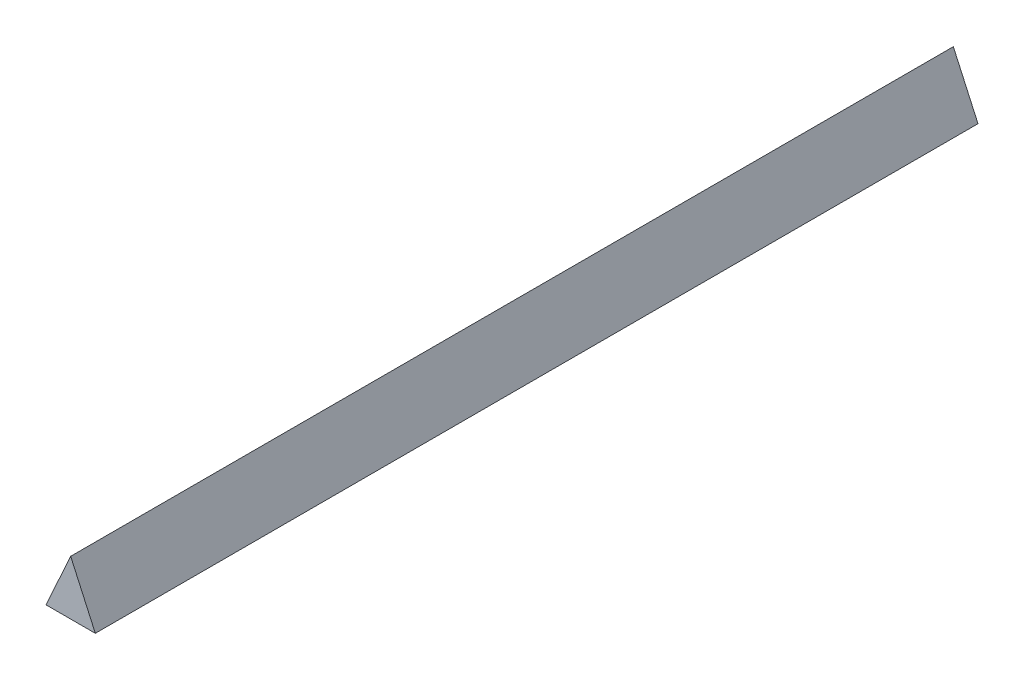
from build123d import *

# Parameters (mm, degrees)
EXTRUDE_1_DEPTH = 34


with BuildPart() as part:
    # Эскиз1 → Бобышка-Вытянуть1 (new body)
    with BuildSketch(Plane.XY):
        Polygon((-0.95, 0), (0.95, 0), (0, 2.094636007), align=None)
    extrude(amount=EXTRUDE_1_DEPTH)


solid = part.part
